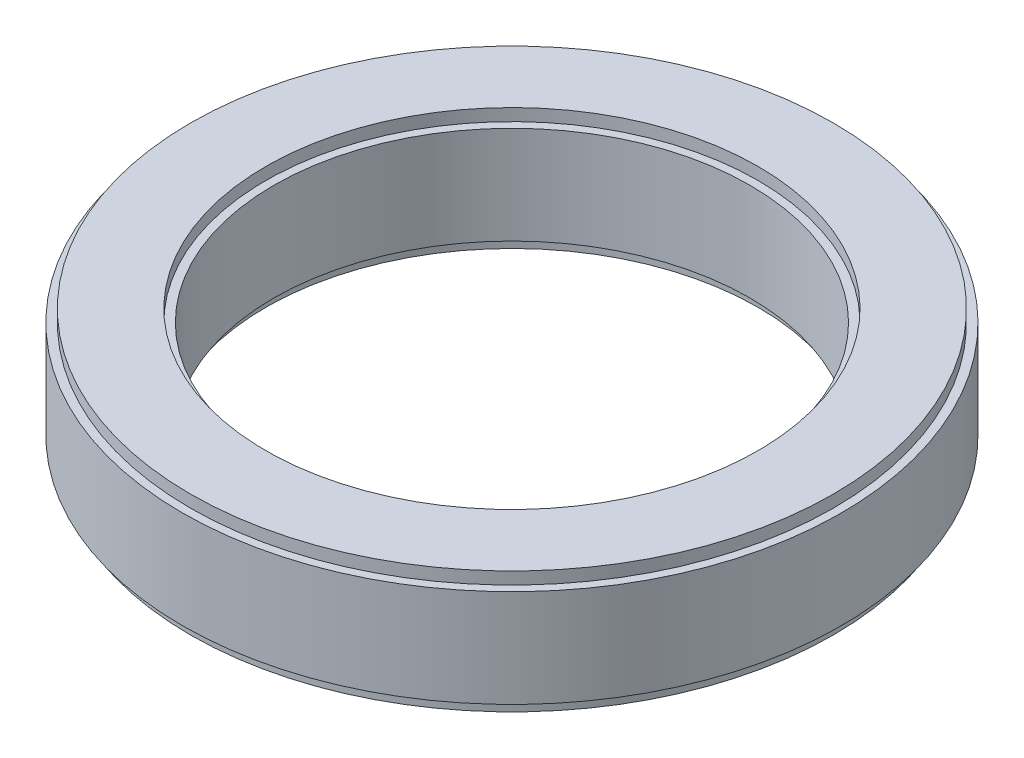
from build123d import *

# Parameters (mm, degrees)
SKETCH1_W = 11.25
SKETCH1_H = 12
SKETCH2_W = 9.25
SKETCH2_H = 15


with BuildPart() as part:
    # Sketch1 → Revolve1 (revolve)
    with BuildSketch(Plane.XY, mode=Mode.PRIVATE) as revolve1_sk:
        with Locations((-34.875, 0)):
            Rectangle(SKETCH1_W, SKETCH1_H)
    revolve(revolve1_sk.sketch.rotate(Axis((0, 0, 0), (0, -1, 0)), 270), axis=Axis((0, 0, 0), (0, -1, 0)))

    # Sketch2 → Revolve2 (revolve)
    with BuildSketch(Plane.XY, mode=Mode.PRIVATE) as revolve2_sk:
        with Locations((-34.875, 0)):
            Rectangle(SKETCH2_W, SKETCH2_H)
    revolve(revolve2_sk.sketch.rotate(Axis((0, 0, 0), (0, 1, 0)), 270), axis=Axis((0, 0, 0), (0, 1, 0)))


solid = part.part
